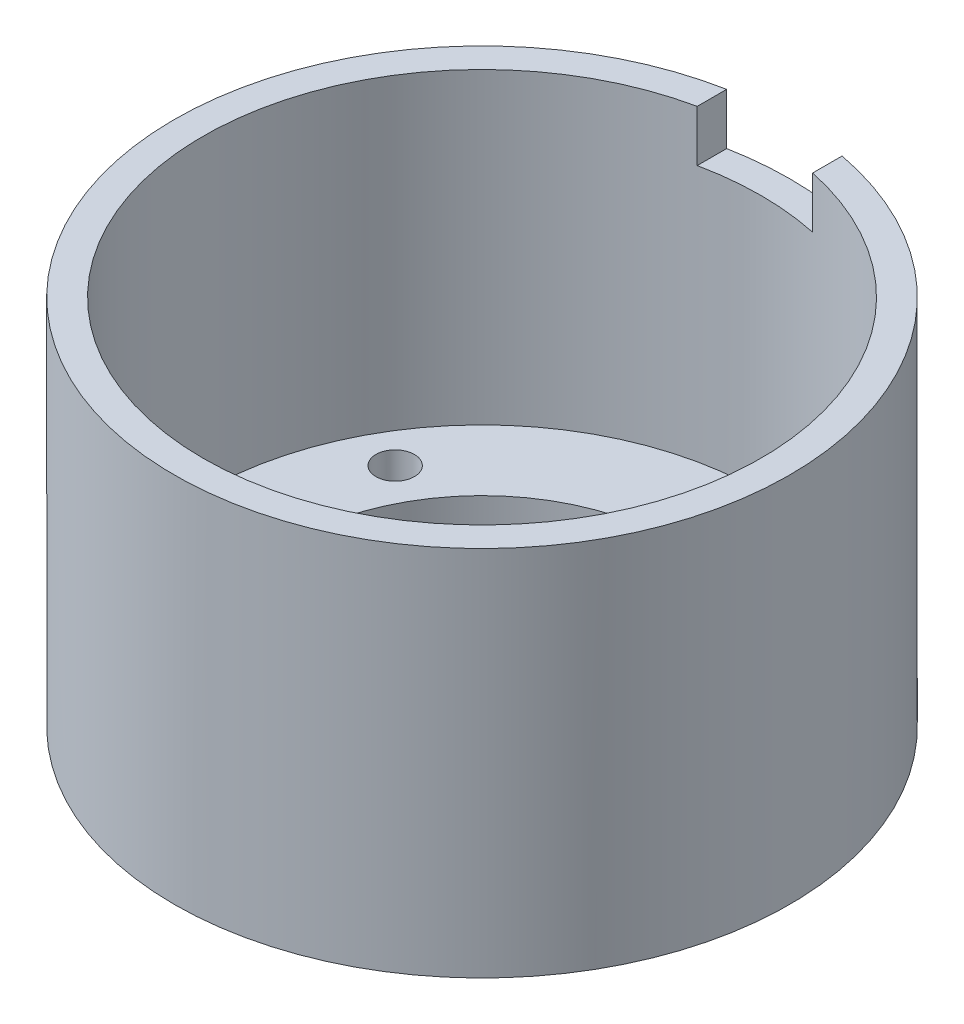
from build123d import *

# Parameters (mm, degrees)
SKETCH1_R               = 24
SKETCH1_R_2             = 21.75
BOSS_EXTRUDE1_DEPTH     = 24
BOSS_EXTRUDE2_START     = 5
SKETCH2_R               = 24
SKETCH2_R_2             = 15
BOSS_EXTRUDE2_DEPTH     = 5
SKETCH3_R               = 2.5
CUT_EXTRUDE1_DEPTH      = 2
SKETCH4_R               = 1.5
CUT_EXTRUDE2_DEPTH      = 44.370496884
CUT_EXTRUDE3_REACH      = 60.788
CUT_EXTRUDE3_END_RADIUS = 21.75
SKETCH5_W               = 9
SKETCH5_H               = 4


with BuildPart() as part:
    # Sketch1 → Boss-Extrude1 (new body)
    with BuildSketch(Plane(origin=(0, 0, 0), x_dir=(1, 0, 0), z_dir=(0, 1, 0))):
        with Locations(Location((0, 0, 0), (0, 0, 270))):
            Circle(SKETCH1_R)
        with Locations(Location((0, 0, 0), (0, 0, 270))):
            Circle(SKETCH1_R_2, mode=Mode.SUBTRACT)
    extrude(amount=BOSS_EXTRUDE1_DEPTH)

    # Sketch2 → Boss-Extrude2 (add)
    with BuildSketch(Plane.XZ.offset(BOSS_EXTRUDE2_START)):
        with Locations(Location((0, 0, 0), (0, 0, 270))):
            Circle(SKETCH2_R)
        with Locations(Location((0, 0, 0), (0, 0, 270))):
            Circle(SKETCH2_R_2, mode=Mode.SUBTRACT)
    extrude(amount=-BOSS_EXTRUDE2_DEPTH)

    # Sketch3 → Cut-Extrude1 (cut)
    with BuildSketch(Plane.XZ.offset(5)):
        with Locations(Location((0, 18.5, 0), (0, 0, 270))):
            Circle(SKETCH3_R)
        with Locations(Location((16.02146997, -9.25, 0), (0, 0, 270))):
            Circle(SKETCH3_R)
        with Locations(Location((-16.02146997, -9.25, 0), (0, 0, 270))):
            Circle(SKETCH3_R)
    extrude(amount=-CUT_EXTRUDE1_DEPTH, mode=Mode.SUBTRACT)

    # Sketch4 → Cut-Extrude2 (cut, through all)
    with BuildSketch(Plane.XZ.offset(3)):
        with Locations(Location((0, 18.5, 0), (0, 0, 270))):
            Circle(SKETCH4_R)
        with Locations(Location((16.02146997, -9.25, 0), (0, 0, 270))):
            Circle(SKETCH4_R)
        with Locations(Location((-16.02146997, -9.25, 0), (0, 0, 270))):
            Circle(SKETCH4_R)
    extrude(amount=-CUT_EXTRUDE2_DEPTH, mode=Mode.SUBTRACT)

    # Cut-Extrude3: up to this cylinder (the profile starts outside it)
    cut_extrude3_end = Plane(origin=(0, 22, 0), z_dir=(0, -1, 0)) * Cylinder(CUT_EXTRUDE3_END_RADIUS, 166.076, mode=Mode.PRIVATE)
    # Sketch5 → Cut-Extrude3 (cut, up to the surface)
    with BuildSketch(Plane(origin=(0, 0, -24), x_dir=(-1, 0, 0), z_dir=(0, 0, -1)), mode=Mode.PRIVATE) as cut_extrude3_sk1:
        with Locations((0, 22)):
            Rectangle(SKETCH5_W, SKETCH5_H)
    cut_extrude3_tool1 = extrude(cut_extrude3_sk1.sketch, amount=-CUT_EXTRUDE3_REACH, mode=Mode.PRIVATE) - cut_extrude3_end
    add(cut_extrude3_tool1.solids().sort_by_distance((0, 22, -24))[0], mode=Mode.SUBTRACT)


solid = part.part
